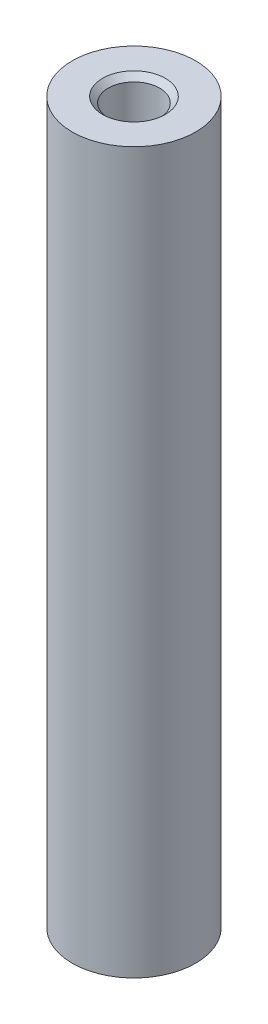
from build123d import *

# Parameters (mm, degrees)
SKETCH_1_R                   = 3
EXTRUDE_1_DEPTH              = 35
HOLE_WIZARD_M3_1_D           = 2.5
HOLE_WIZARD_M3_1_CSINK_D     = 3.05
HOLE_WIZARD_M3_1_CSINK_ANGLE = 90


with BuildPart() as part:
    # 草图1 → 凸台-拉伸1 (new body)
    with BuildSketch(Plane(origin=(0, 0, 0), x_dir=(1, 0, 0), z_dir=(0, 1, 0))):
        with Locations(Location((0, 0, 0), (0, 0, 270))):
            Circle(SKETCH_1_R)
    extrude(amount=EXTRUDE_1_DEPTH)

    # M3 螺纹孔1 (through all)
    with Locations(Plane(origin=(0, 35, 0), x_dir=(1, 0, 0), z_dir=(0, 1, 0))):
        with Locations((0, 0)):
            CounterSinkHole(HOLE_WIZARD_M3_1_D / 2, HOLE_WIZARD_M3_1_CSINK_D / 2, counter_sink_angle=HOLE_WIZARD_M3_1_CSINK_ANGLE)


solid = part.part
